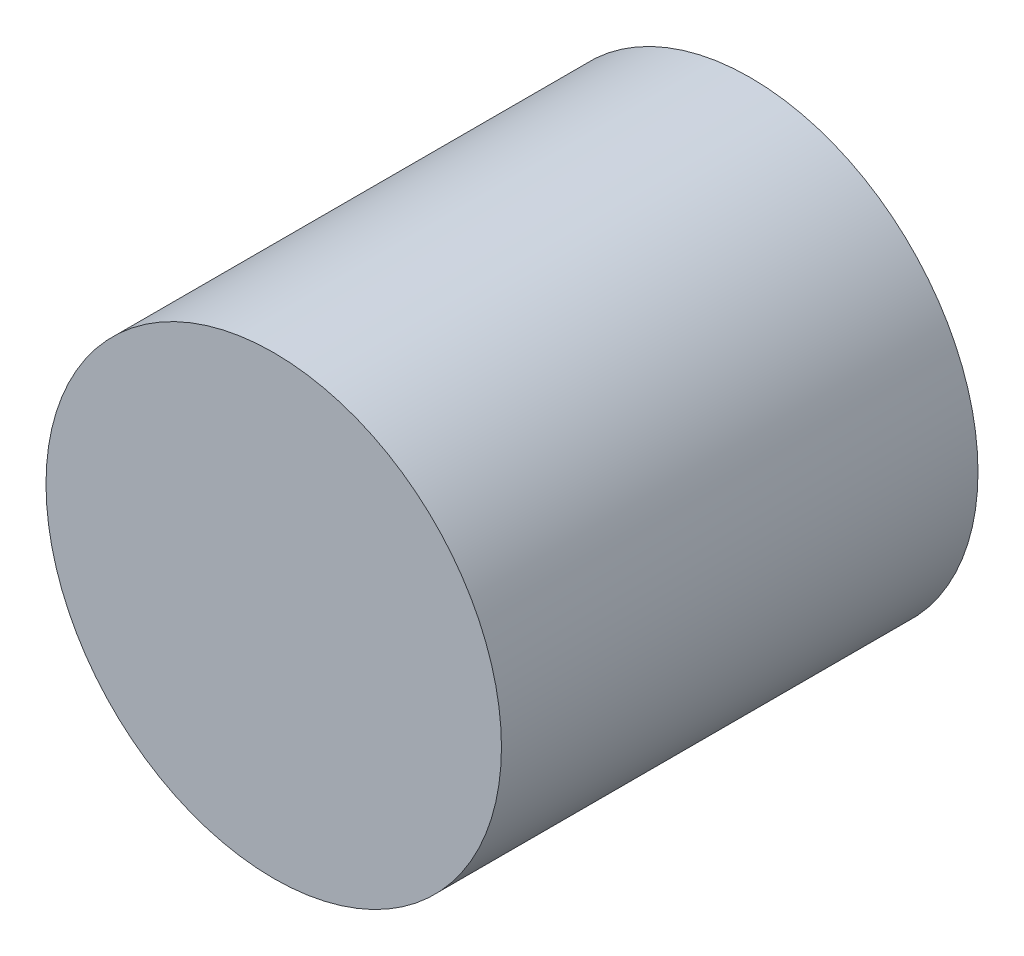
from build123d import *

# Parameters (mm, degrees)
SKETCH1_R           = 49.523361274
BOSS_EXTRUDE1_DEPTH = 103.632


with BuildPart() as part:
    # Sketch1 → Boss-Extrude1 (new body)
    with BuildSketch(Plane.XY):
        Circle(SKETCH1_R)
    extrude(amount=-BOSS_EXTRUDE1_DEPTH)


solid = part.part
